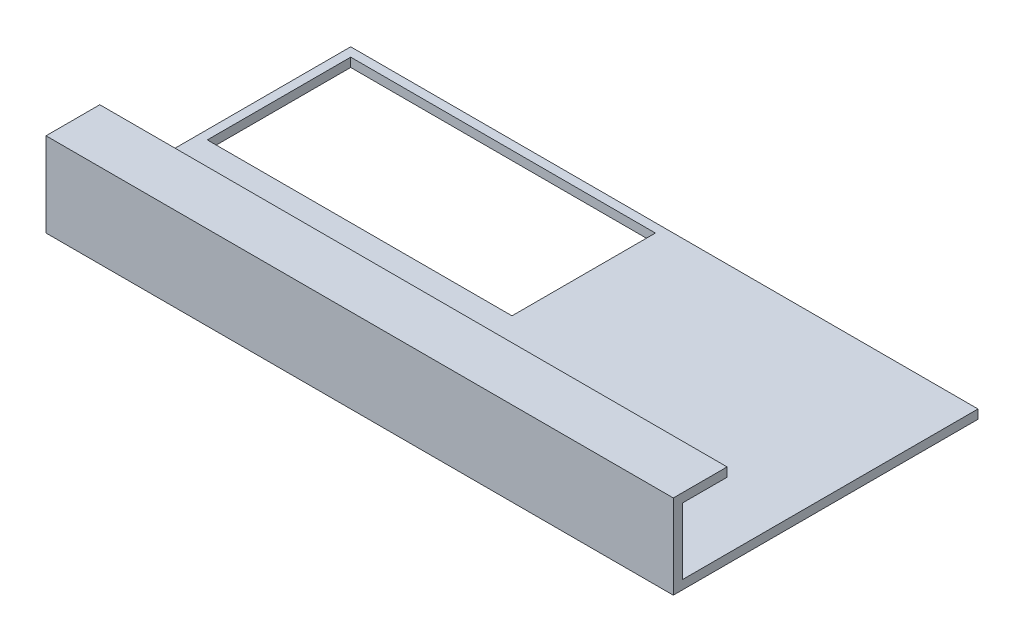
from build123d import *

# Parameters (mm, degrees)
SKETCH1_W           = 175
SKETCH1_H           = 85
BOSS_EXTRUDE1_DEPTH = 2.5
SKETCH2_W           = 85
SKETCH2_H           = 40
CUT_EXTRUDE1_DEPTH  = 2.5
SKETCH3_W           = 175
SKETCH3_H           = 2.5
BOSS_EXTRUDE2_DEPTH = 18.5
SKETCH4_W           = 175
SKETCH4_H           = 15.004979699
BOSS_EXTRUDE3_DEPTH = 2.5


with BuildPart() as part:
    # Sketch1 → Boss-Extrude1 (new body)
    with BuildSketch(Plane(origin=(0, 0, 0), x_dir=(1, 0, 0), z_dir=(0, 1, 0))):
        Rectangle(SKETCH1_W, SKETCH1_H)
    extrude(amount=BOSS_EXTRUDE1_DEPTH)

    # Sketch2 → Cut-Extrude1 (cut)
    with BuildSketch(Plane.XZ):
        with Locations((-42.5, -20)):
            Rectangle(SKETCH2_W, SKETCH2_H)
    extrude(amount=-CUT_EXTRUDE1_DEPTH, mode=Mode.SUBTRACT)

    # Sketch3 → Boss-Extrude2 (add)
    with BuildSketch(Plane(origin=(0, 2.5, 0), x_dir=(1, 0, 0), z_dir=(0, 1, 0))):
        with Locations((0, -41.25)):
            Rectangle(SKETCH3_W, SKETCH3_H)
    extrude(amount=BOSS_EXTRUDE2_DEPTH)

    # Sketch4 → Boss-Extrude3 (add)
    with BuildSketch(Plane(origin=(0, 21, 0), x_dir=(1, 0, 0), z_dir=(0, 1, 0))):
        with Locations((0, -34.99751015)):
            Rectangle(SKETCH4_W, SKETCH4_H)
    extrude(amount=BOSS_EXTRUDE3_DEPTH)


solid = part.part
